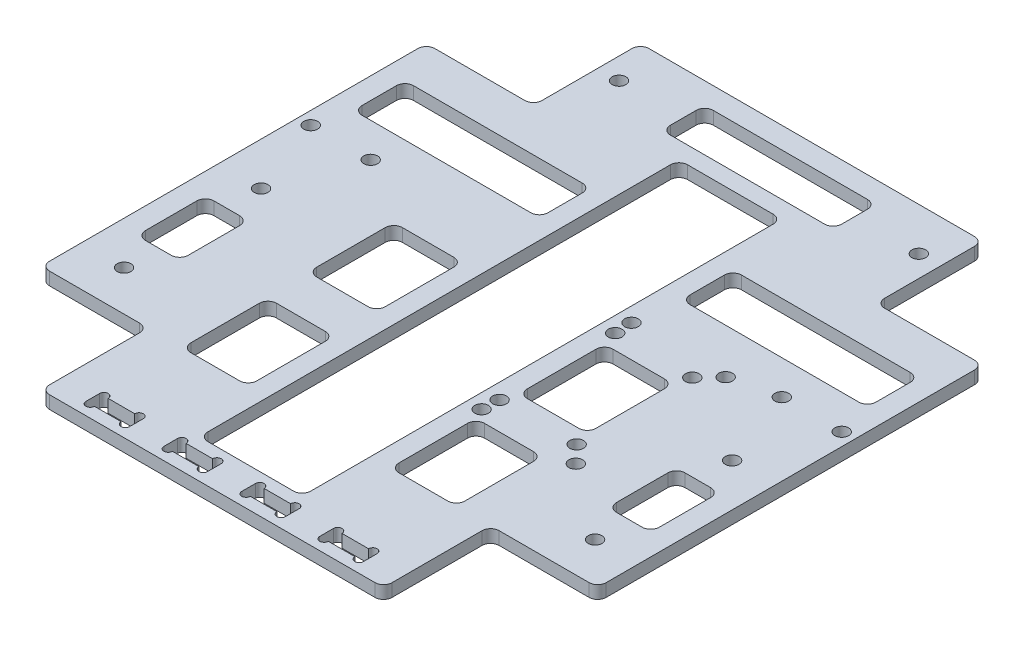
from build123d import *

# Parameters (mm, degrees)
SKETCH_1_W          = 130
SKETCH_1_H          = 140
SKETCH_1_R          = 1.6
SKETCH_1_W_2        = 24
SKETCH_1_H_2        = 112
EXTRUDE_1_DEPTH     = 3
SKETCH_2_W          = 25
SKETCH_2_H          = 25
CUT_EXTRUDE_1_DEPTH = 3
SKETCH_3_W          = 40
SKETCH_3_H          = 10
SKETCH_3_W_2        = 15.4
SKETCH_3_H_2        = 20
SKETCH_3_W_3        = 16
SKETCH_3_W_4        = 43.4
SKETCH_3_H_3        = 12
SKETCH_3_W_5        = 10
SKETCH_3_H_4        = 16
CUT_EXTRUDE_2_DEPTH = 192.07328437
FILLET_1_R          = 2


with BuildPart() as part:
    # 草图1 → 凸台-拉伸1 (new body)
    with BuildSketch(Plane(origin=(0, 0, 0), x_dir=(1, 0, 0), z_dir=(0, 1, 0))):
        with Locations((65, 70)):
            Rectangle(SKETCH_1_W, SKETCH_1_H)
        with Locations(Location((98.6, 78.5, 0), (0, 0, 270))):
            Circle(SKETCH_1_R, mode=Mode.SUBTRACT)
        with Locations(Location((80.6, 78.5, 0), (0, 0, 90))):
            Circle(SKETCH_1_R, mode=Mode.SUBTRACT)
        with Locations(Location((98.6, 51.5, 0), (0, 0, 90))):
            Circle(SKETCH_1_R, mode=Mode.SUBTRACT)
        with Locations(Location((80.6, 51.5, 0), (0, 0, 270))):
            Circle(SKETCH_1_R, mode=Mode.SUBTRACT)
        with Locations(Location((127, 85, 0), (0, 0, 270))):
            Circle(SKETCH_1_R, mode=Mode.SUBTRACT)
        with Locations(Location((113, 85, 0), (0, 0, 90))):
            Circle(SKETCH_1_R, mode=Mode.SUBTRACT)
        with Locations(Location((120, 66.4, 0), (0, 0, 270))):
            Circle(SKETCH_1_R, mode=Mode.SUBTRACT)
        with Locations(Location((120, 34.4, 0), (0, 0, 270))):
            Circle(SKETCH_1_R, mode=Mode.SUBTRACT)
        with Locations(Location((10, 34.4, 0), (0, 0, 90))):
            Circle(SKETCH_1_R, mode=Mode.SUBTRACT)
        with Locations(Location((10, 66.4, 0), (0, 0, 90))):
            Circle(SKETCH_1_R, mode=Mode.SUBTRACT)
        with Locations(Location((3, 85, 0), (0, 0, 90))):
            Circle(SKETCH_1_R, mode=Mode.SUBTRACT)
        with Locations(Location((17, 85, 0), (0, 0, 270))):
            Circle(SKETCH_1_R, mode=Mode.SUBTRACT)
        with Locations(Location((30, 130, 0), (0, 0, 270))):
            Circle(SKETCH_1_R, mode=Mode.SUBTRACT)
        with Locations(Location((100, 130, 0), (0, 0, 90))):
            Circle(SKETCH_1_R, mode=Mode.SUBTRACT)
        with Locations(Location((80.4, 82.5, 0), (0, 0, 270))):
            Circle(SKETCH_1_R, mode=Mode.SUBTRACT)
        with Locations(Location((80.4, 47.5, 0), (0, 0, 90))):
            Circle(SKETCH_1_R, mode=Mode.SUBTRACT)
        with Locations(Location((102.4, 82.5, 0), (0, 0, 270))):
            Circle(SKETCH_1_R, mode=Mode.SUBTRACT)
        with Locations(Location((102.4, 47.5, 0), (0, 0, 90))):
            Circle(SKETCH_1_R, mode=Mode.SUBTRACT)
        with Locations((65, 65)):
            Rectangle(SKETCH_1_W_2, SKETCH_1_H_2, mode=Mode.SUBTRACT)
    extrude(amount=EXTRUDE_1_DEPTH)

    # 草图2 → 切除-拉伸1 (cut)
    with BuildSketch(Plane(origin=(0, 3, 0), x_dir=(1, 0, 0), z_dir=(0, 1, 0))):
        with Locations((12.5, 127.5)):
            Rectangle(SKETCH_2_W, SKETCH_2_H)
        with Locations((12.5, 12.5)):
            Rectangle(SKETCH_2_W, SKETCH_2_H)
        with Locations((117.5, 12.5)):
            Rectangle(SKETCH_2_W, SKETCH_2_H)
        with Locations((117.5, 127.5)):
            Rectangle(SKETCH_2_W, SKETCH_2_H)
        with BuildLine():
            Line((59, 6.1), (52.8, 6.1))
            ThreePointArc((52.8, 6.1), (51.8, 7.1), (50.8, 6.1))
            Line((50.8, 6.1), (50.8, 2.9))
            ThreePointArc((50.8, 2.9), (51.8, 1.9), (52.8, 2.9))
            Line((52.8, 2.9), (59, 2.9))
            ThreePointArc((59, 2.9), (60, 1.9), (61, 2.9))
            Line((61, 2.9), (61, 6.1))
            ThreePointArc((61, 6.1), (60, 7.1), (59, 6.1))
        make_face()
        with BuildLine():
            ThreePointArc((34.6, 6.1), (33.6, 7.1), (32.6, 6.1))
            Line((32.6, 6.1), (32.6, 2.9))
            ThreePointArc((32.6, 2.9), (33.6, 1.9), (34.6, 2.9))
            Line((34.6, 2.9), (40.8, 2.9))
            ThreePointArc((40.8, 2.9), (41.8, 1.9), (42.8, 2.9))
            Line((42.8, 2.9), (42.8, 6.1))
            ThreePointArc((42.8, 6.1), (41.8, 7.1), (40.8, 6.1))
            Line((40.8, 6.1), (34.6, 6.1))
        make_face()
        with BuildLine():
            Line((77.2, 6.1), (71, 6.1))
            ThreePointArc((71, 6.1), (70, 7.1), (69, 6.1))
            Line((69, 6.1), (69, 2.9))
            ThreePointArc((69, 2.9), (70, 1.9), (71, 2.9))
            Line((71, 2.9), (77.2, 2.9))
            ThreePointArc((77.2, 2.9), (78.2, 1.9), (79.2, 2.9))
            Line((79.2, 2.9), (79.2, 6.1))
            ThreePointArc((79.2, 6.1), (78.2, 7.1), (77.2, 6.1))
        make_face()
        with BuildLine():
            Line((95.4, 6.1), (89.2, 6.1))
            ThreePointArc((89.2, 6.1), (88.2, 7.1), (87.2, 6.1))
            Line((87.2, 6.1), (87.2, 2.9))
            ThreePointArc((87.2, 2.9), (88.2, 1.9), (89.2, 2.9))
            Line((89.2, 2.9), (95.4, 2.9))
            ThreePointArc((95.4, 2.9), (96.4, 1.9), (97.4, 2.9))
            Line((97.4, 2.9), (97.4, 6.1))
            ThreePointArc((97.4, 6.1), (96.4, 7.1), (95.4, 6.1))
        make_face()
    extrude(amount=-CUT_EXTRUDE_1_DEPTH, mode=Mode.SUBTRACT)

    # 草图3 → 切除-拉伸2 (cut, through all)
    with BuildSketch(Plane(origin=(0, 3, 0), x_dir=(1, 0, 0), z_dir=(0, 1, 0))):
        with Locations((65, 130)):
            Rectangle(SKETCH_3_W, SKETCH_3_H)
        with Locations((40.7, 35)):
            Rectangle(SKETCH_3_W_2, SKETCH_3_H_2)
        with Locations((89.6, 65)):
            Rectangle(SKETCH_3_W_3, SKETCH_3_H_2)
        with Locations((103.3, 99)):
            Rectangle(SKETCH_3_W_4, SKETCH_3_H_3)
        with Locations((89.3, 35)):
            Rectangle(SKETCH_3_W_2, SKETCH_3_H_2)
        with Locations((120, 50.4)):
            Rectangle(SKETCH_3_W_5, SKETCH_3_H_4)
        with Locations((10, 50.4)):
            Rectangle(SKETCH_3_W_5, SKETCH_3_H_4)
        with Locations((40.4, 65)):
            Rectangle(SKETCH_3_W_3, SKETCH_3_H_2)
        with Locations((26.7, 99)):
            Rectangle(SKETCH_3_W_4, SKETCH_3_H_3)
    extrude(amount=-CUT_EXTRUDE_2_DEPTH, mode=Mode.SUBTRACT)

    # 圆角1
    fillet_1_edges = [part.edges().sort_by_distance(p)[0] for p in [
        (105, 1.5, -140),
        (130, 1.5, -115),
        (105, 1.5, -115),
        (105, 1.5, 0),
        (105, 1.5, -25),
        (130, 1.5, -25),
        (25, 1.5, 0),
        (0, 1.5, -25),
        (25, 1.5, -25),
        (25, 1.5, -140),
        (25, 1.5, -115),
        (0, 1.5, -115),
        (85, 1.5, -135),
        (85, 1.5, -125),
        (45, 1.5, -125),
        (45, 1.5, -135),
        (125, 1.5, -58.4),
        (125, 1.5, -42.4),
        (115, 1.5, -42.4),
        (115, 1.5, -58.4),
        (15, 1.5, -58.4),
        (15, 1.5, -42.4),
        (5, 1.5, -42.4),
        (5, 1.5, -58.4),
        (48.4, 1.5, -75),
        (48.4, 1.5, -55),
        (32.4, 1.5, -55),
        (32.4, 1.5, -75),
        (48.4, 1.5, -105),
        (48.4, 1.5, -93),
        (5, 1.5, -93),
        (5, 1.5, -105),
        (48.4, 1.5, -45),
        (48.4, 1.5, -25),
        (33, 1.5, -25),
        (33, 1.5, -45),
        (97.6, 1.5, -75),
        (97.6, 1.5, -55),
        (81.6, 1.5, -55),
        (81.6, 1.5, -75),
        (125, 1.5, -105),
        (125, 1.5, -93),
        (81.6, 1.5, -93),
        (81.6, 1.5, -105),
        (97, 1.5, -45),
        (97, 1.5, -25),
        (81.6, 1.5, -25),
        (81.6, 1.5, -45),
        (77, 1.5, -9),
        (77, 1.5, -121),
        (53, 1.5, -121),
        (53, 1.5, -9),
    ]]
    fillet(fillet_1_edges, radius=FILLET_1_R)


solid = part.part
